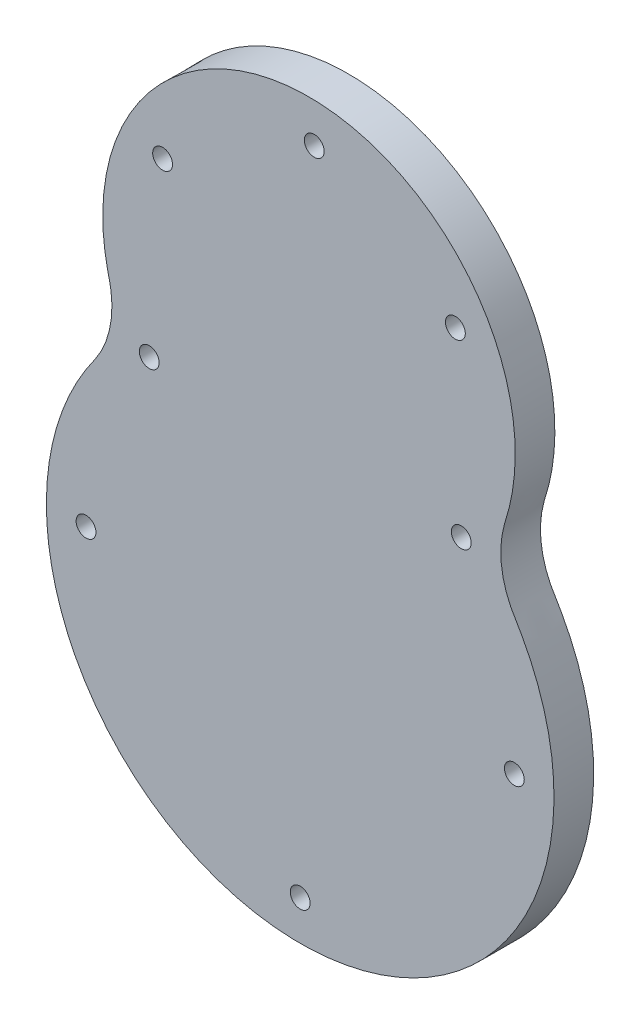
from build123d import *

# Parameters (mm, degrees)
BOSS_EXTRUDE1_DEPTH = 5
M3_TAPPED_HOLE1_D   = 2.5


with BuildPart() as part:
    # Sketch2 → Boss-Extrude1 (new body)
    with BuildSketch(Plane.XY):
        with BuildLine():
            add(Edge.make_bspline(
                [(-24.624048625, 31.26183802), (-27.119462873, 48.520584478), (-15.49775058, 61.52163155), (1.93172068, 60.969405895), (19.361191939, 60.417180241), (30.136585249, 46.706515757), (26.553639696, 29.640352663), (26.432536713, 29.063519101), (26.151101035, 27.918088035), (25.590360607, 26.22900222), (25.394154334, 25.063387484), (25.339288005, 24.476537778), (25.175929343, 22.72925517), (25.393685504, 20.987915221), (25.982283854, 19.334665528), (26.181303682, 18.775660445), (26.662268447, 17.687173697), (27.628390485, 16.178053515), (28.199560951, 15.137267183), (28.470462116, 14.609339031), (40.960791538, -9.73162875), (26.331481163, -32.850329395), (-1.013361668, -31.983950634), (-28.358204499, -31.117571872), (-41.494682395, -7.119155464), (-27.488539888, 16.382312865), (-27.184762446, 16.892033221), (-26.548852308, 17.894575084), (-25.489135644, 19.339509722), (-24.940230689, 20.395366651), (-24.70622314, 20.940651936), (-24.014149097, 22.553325519), (-23.686597049, 24.277388227), (-23.739019245, 26.031507515), (-23.756625984, 26.620653417), (-23.878651428, 27.796350829), (-24.331342425, 29.517545641), (-24.539704026, 30.678495171), (-24.624048625, 31.26183802)],
                knots=[0, 0, 0, 0, 0.179793799, 0.179793799, 0.179793799, 0.359587598, 0.359587598, 0.359587598, 0.367566109, 0.37554462, 0.38352313, 0.38352313, 0.38352313, 0.406904748, 0.406904748, 0.406904748, 0.414936964, 0.42296918, 0.431001397, 0.431001397, 0.431001397, 0.679793799, 0.679793799, 0.679793799, 0.928586202, 0.928586202, 0.928586202, 0.936618418, 0.944650634, 0.952682851, 0.952682851, 0.952682851, 0.976064468, 0.976064468, 0.976064468, 0.984042979, 0.992021489, 1, 1, 1, 1], degree=3, weights=[1, 0.761671162, 0.761671162, 1, 0.761671162, 0.761671162, 1, 1, 1, 1, 1, 1, 0.984275022, 0.984275022, 1, 1, 1, 1, 1, 1, 0.671797987, 0.671797987, 1, 0.671797987, 0.671797987, 1, 1, 1, 1, 1, 1, 0.984275022, 0.984275022, 1, 1, 1, 1, 1, 1]))
        make_face()
    extrude(amount=-BOSS_EXTRUDE1_DEPTH)

    # M3 Tapped Hole1 (through all)
    with Locations(Plane.XY):
        with Locations((1.773382919, 55.971913609), (19.56503282, 45), (20.308924933, 22.5), (27, 0), (0, -27), (-27, 0), (-19.032413112, 22.5), (-17.348304171, 45)):
            Hole(M3_TAPPED_HOLE1_D / 2)


solid = part.part
